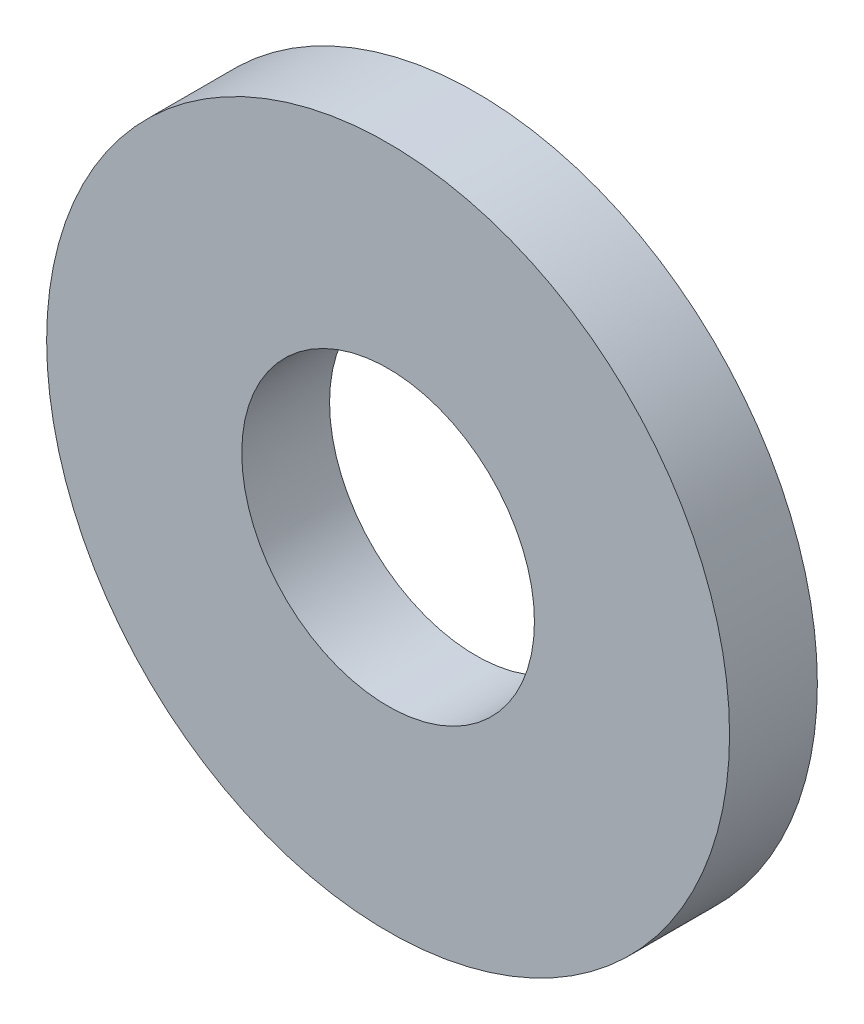
from build123d import *

# Parameters (mm, degrees)
BOSS_EXTRUDE1_DEPTH      = 0.4572
BOSS_EXTRUDE1_DEPTH_BACK = 0.4572
SKETCH3_R                = 3.556
SKETCH3_R_2              = 1.524


with BuildPart() as part:
    # Sketch3 → Boss-Extrude1 (new, two sides: drawn at the far end of the back side and taken through both)
    with BuildSketch(Plane.XY.offset(-BOSS_EXTRUDE1_DEPTH_BACK)):
        Circle(SKETCH3_R)
        Circle(SKETCH3_R_2, mode=Mode.SUBTRACT)
    extrude(amount=BOSS_EXTRUDE1_DEPTH + BOSS_EXTRUDE1_DEPTH_BACK)


solid = part.part
